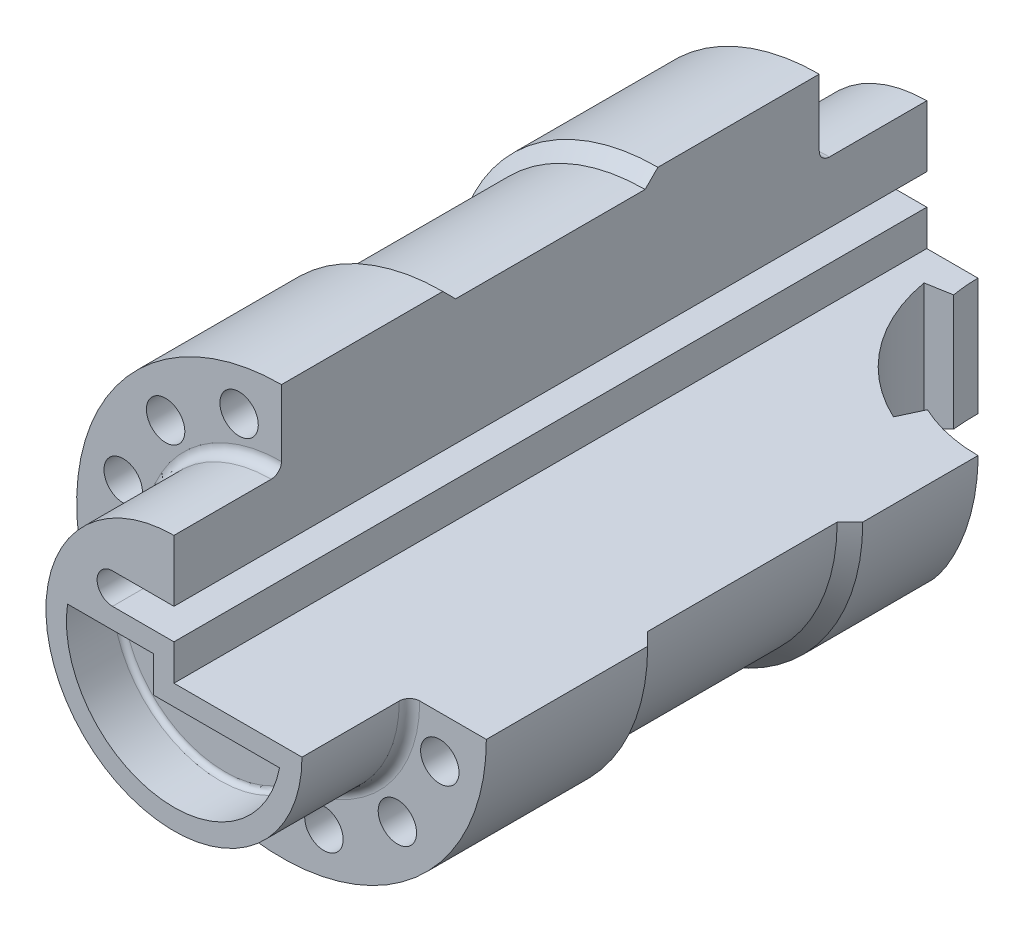
from build123d import *

# Parameters (mm, degrees)
SKETCH1_R             = 40
BOSS_EXTRUDE1_DEPTH   = 105
SKETCH2_R             = 25
BOSS_EXTRUDE2_DEPTH   = 21
BOSS_EXTRUDE3_START   = 21
SKETCH3_R             = 25
BOSS_EXTRUDE3_DEPTH   = 21
FILLET1_R             = 2
SKETCH5_W             = 45.050033199
SKETCH5_H             = 42.615736352
CUT_EXTRUDE1_DEPTH    = 158.508729917
CUT_EXTRUDE2_DEPTH    = 158.508729917
SKETCH8_R             = 3.75
CUT_EXTRUDE3_DEPTH    = 158.508729917
CUT_EXTRUDE4_DEPTH    = 139.115893365
CUT_EXTRUDE5_DEPTH    = 10
FILLET2_R             = 1
BODY_MOVE_COPY1_ANGLE = 90


with BuildPart() as part:
    # Sketch1 → Boss-Extrude1 (new body)
    with BuildSketch(Plane(origin=(0, 0, 0), x_dir=(1, 0, 0), z_dir=(0, 1, 0))):
        with Locations(Location((0, 0, 0), (0, 0, 270))):
            Circle(SKETCH1_R)
    extrude(amount=BOSS_EXTRUDE1_DEPTH)

    # Sketch2 → Boss-Extrude2 (add)
    with BuildSketch(Plane(origin=(0, 105, 0), x_dir=(1, 0, 0), z_dir=(0, 1, 0))):
        with Locations(Location((0, 0, 0), (0, 0, 90))):
            Circle(SKETCH2_R)
    extrude(amount=BOSS_EXTRUDE2_DEPTH)

    # Sketch3 → Boss-Extrude3 (add)
    with BuildSketch(Plane(origin=(0, 0, 0), x_dir=(-1, 0, 0), z_dir=(0, -1, 0)).offset(BOSS_EXTRUDE3_START)):
        with Locations(Location((0, 0, 0), (0, 0, 90))):
            Circle(SKETCH3_R)
    extrude(amount=-BOSS_EXTRUDE3_DEPTH)

    # Fillet1
    fillet1_edges = [part.edges().sort_by_distance(p)[0] for p in [
        (0, 0, 25),
        (0, 105, 25),
    ]]
    fillet(fillet1_edges, radius=FILLET1_R)

    # Sketch4 → Cut-Revolve1 (revolve, cut)
    with BuildSketch(Plane(origin=(0, 0, 0), x_dir=(0, 0, -1), z_dir=(1, 0, 0)), mode=Mode.PRIVATE) as cut_revolve1_sk:
        Polygon((40, 73.5), (37.5, 71), (37.5, 34), (40, 31.5), align=None)
    revolve(cut_revolve1_sk.sketch.rotate(Axis((0, 105, 0), (0, -1, 0)), 180), axis=Axis((0, 105, 0), (0, -1, 0)), mode=Mode.SUBTRACT)

    # Sketch5 → Cut-Extrude1 (cut, through all)
    with BuildSketch(Plane(origin=(0, -21, 0), x_dir=(-1, 0, 0), z_dir=(0, -1, 0))):
        with Locations((-22.5250166, -21.307868176)):
            Rectangle(SKETCH5_W, SKETCH5_H)
    extrude(amount=-CUT_EXTRUDE1_DEPTH, mode=Mode.SUBTRACT)

    # Sketch7 → Cut-Extrude2 (cut, through all)
    with BuildSketch(Plane(origin=(0, -21, 0), x_dir=(-1, 0, 0), z_dir=(0, -1, 0))):
        with BuildLine():
            Line((12, -13), (-12, -13))
            ThreePointArc((-12, -13), (-15, -10), (-12, -7))
            Line((-12, -7), (12, -7))
            ThreePointArc((12, -7), (15, -10), (12, -13))
        make_face()
    extrude(amount=-CUT_EXTRUDE2_DEPTH, mode=Mode.SUBTRACT)

    # Sketch8 → Cut-Extrude3 (cut, through all)
    with BuildSketch(Plane(origin=(0, -21, 0), x_dir=(-1, 0, 0), z_dir=(0, -1, 0))):
        with Locations(Location((8.282209443, -30.909626441, 0), (0, 0, 270))):
            Circle(SKETCH8_R)
        with Locations((-8.282209443, -30.909626441)):
            Circle(SKETCH8_R)
        with Locations((-22.627416998, -22.627416998)):
            Circle(SKETCH8_R)
        with Locations((-30.909626441, -8.282209443)):
            Circle(SKETCH8_R)
        with Locations(Location((-30.909626441, 8.282209443, 0), (0, 0, 270))):
            Circle(SKETCH8_R)
        with Locations(Location((-22.627416998, 22.627416998, 0), (0, 0, 270))):
            Circle(SKETCH8_R)
        with Locations(Location((-8.282209443, 30.909626441, 0), (0, 0, 270))):
            Circle(SKETCH8_R)
        with Locations(Location((8.282209443, 30.909626441, 0), (0, 0, 270))):
            Circle(SKETCH8_R)
        with Locations(Location((22.627416998, 22.627416998, 0), (0, 0, 270))):
            Circle(SKETCH8_R)
        with Locations(Location((30.909626441, 8.282209443, 0), (0, 0, 270))):
            Circle(SKETCH8_R)
        with Locations(Location((30.909626441, -8.282209443, 0), (0, 0, 270))):
            Circle(SKETCH8_R)
        with Locations(Location((22.627416998, -22.627416998, 0), (0, 0, 270))):
            Circle(SKETCH8_R)
    extrude(amount=-CUT_EXTRUDE3_DEPTH, mode=Mode.SUBTRACT)

    # Sketch9 → Cut-Extrude4 (cut, through all)
    with BuildSketch(Plane.XY):
        with BuildLine():
            Line((25, 123.355095289), (40, 126))
            Line((40, 126), (30.207539179, 105))
            Line((30.207539179, 105), (40, 105))
            Line((40, 105), (40, 96))
            ThreePointArc((40, 96), (61.213203436, 104.786796564), (70, 126))
            ThreePointArc((70, 126), (40, 156), (10, 126))
            Line((10, 126), (25, 126))
            Line((25, 126), (25, 123.355095289))
        make_face()
        with BuildLine():
            Line((30.207539179, 105), (40, 126))
            Line((40, 126), (25, 123.355095289))
            Line((25, 123.355095289), (25, 107))
            ThreePointArc((25, 107), (25.585786438, 105.585786438), (27, 105))
            Line((27, 105), (30.207539179, 105))
        make_face()
        with BuildLine():
            ThreePointArc((27.321452148, 98.810766389), (16.199399791, 107.73715713), (10.45576741, 120.79055467))
            Line((10.45576741, 120.79055467), (5.531728645, 119.922313782))
            ThreePointArc((5.531728645, 119.922313782), (12.23263309, 104.693349985), (25.208360839, 94.279227454))
            Line((25.208360839, 94.279227454), (27.321452148, 98.810766389))
        make_face()
        with BuildLine():
            Line((25, 107), (25, 123.355095289))
            Line((25, 123.355095289), (10.45576741, 120.79055467))
            ThreePointArc((10.45576741, 120.79055467), (16.199399791, 107.73715713), (27.321452148, 98.810766389))
            Line((27.321452148, 98.810766389), (30.207539179, 105))
            Line((30.207539179, 105), (27, 105))
            ThreePointArc((27, 105), (25.585786438, 105.585786438), (25, 107))
        make_face()
        with BuildLine():
            Line((10.45576741, 120.79055467), (25, 123.355095289))
            Line((25, 123.355095289), (25, 126))
            Line((25, 126), (10, 126))
            ThreePointArc((10, 126), (10.114159057, 123.385327718), (10.45576741, 120.79055467))
        make_face()
        with BuildLine():
            Line((40, 105), (30.207539179, 105))
            Line((30.207539179, 105), (27.321452148, 98.810766389))
            ThreePointArc((27.321452148, 98.810766389), (33.506811582, 96.711119786), (40, 96))
            Line((40, 96), (40, 105))
        make_face()
    extrude(amount=-CUT_EXTRUDE4_DEPTH, mode=Mode.SUBTRACT)

    # Sketch10 → Cut-Extrude5 (cut)
    with BuildSketch(Plane(origin=(0, -21, 0), x_dir=(-1, 0, 0), z_dir=(0, -1, 0))):
        with BuildLine():
            Line((4, -3), (4, 4))
            Line((4, 4), (-20.615528128, 4))
            ThreePointArc((-20.615528128, 4), (3.501020872, 20.706106656), (20.784609691, -3))
            Line((20.784609691, -3), (4, -3))
        make_face()
    extrude(amount=-CUT_EXTRUDE5_DEPTH, mode=Mode.SUBTRACT)

    # Fillet2
    fillet2_edges = [part.edges().sort_by_distance(p)[0] for p in [
        (-12.392304845, -11, 3),
        (-4, -11, -0.5),
        (8.307764064, -11, -4),
        (-3.501020872, -11, -20.706106656),
    ]]
    fillet(fillet2_edges, radius=FILLET2_R)


with BuildPart() as part_1:
    # Body-Move/Copy1: moved
    add(part.part.rotate(Axis((0, 52.5, 0), (-1, 0, 0)), BODY_MOVE_COPY1_ANGLE))


solid = part_1.part
